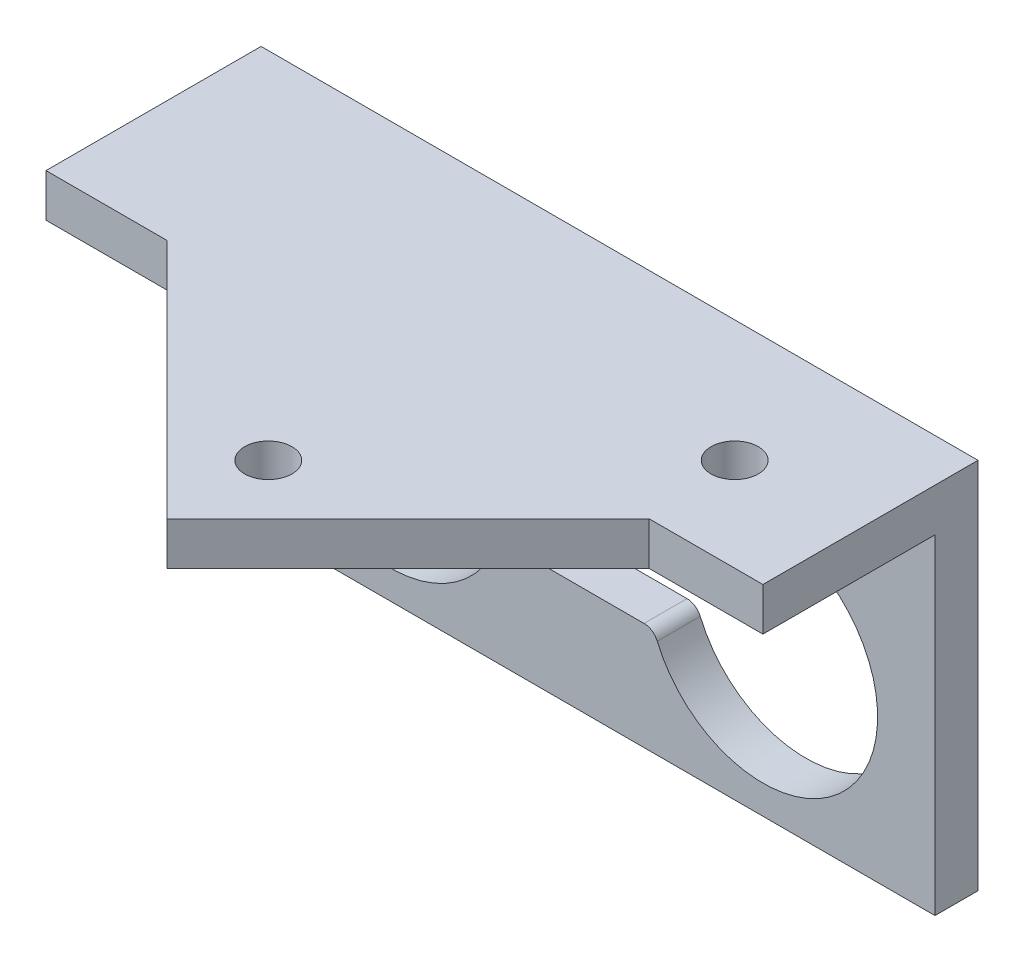
from build123d import *

# Parameters (mm, degrees)
SKETCH_1_W          = 50
SKETCH_1_H          = 20
EXTRUDE_1_DEPTH     = 3
SKETCH_2_W          = 50
SKETCH_2_H          = 15
EXTRUDE_2_DEPTH     = 6
SKETCH_5_W          = 50
SKETCH_5_H          = 12
CUT_EXTRUDE_2_DEPTH = 3
SKETCH_7_R          = 1.65
EXTRUDE_3_DEPTH     = 3
SKETCH_8_R          = 1.65
CUT_EXTRUDE_3_DEPTH = 3


with BuildPart() as part:
    # 草图1 → 凸台-拉伸1 (new body)
    with BuildSketch(Plane.XY):
        Rectangle(SKETCH_1_W, SKETCH_1_H)
        with BuildLine():
            Line((-4.708438024, 2.5), (4.708438024, 2.5))
            ThreePointArc((4.708438024, 2.5), (5.261208823, 2.666666667), (5.629722688, 3.111111111))
            ThreePointArc((5.629722688, 3.111111111), (21, 0), (5.629722688, -3.111111111))
            ThreePointArc((5.629722688, -3.111111111), (5.261208823, -2.666666667), (4.708438024, -2.5))
            Line((4.708438024, -2.5), (-4.708438024, -2.5))
            ThreePointArc((-4.708438024, -2.5), (-5.261208823, -2.666666667), (-5.629722688, -3.111111111))
            ThreePointArc((-5.629722688, -3.111111111), (-21, 0), (-5.629722688, 3.111111111))
            ThreePointArc((-5.629722688, 3.111111111), (-5.261208823, 2.666666667), (-4.708438024, 2.5))
        make_face(mode=Mode.SUBTRACT)
        with BuildLine():
            Line((3.25, 5.5), (-3.25, 5.5))
            ThreePointArc((-3.25, 5.5), (-5, 7.25), (-3.25, 9))
            Line((-3.25, 9), (3.25, 9))
            ThreePointArc((3.25, 9), (5, 7.25), (3.25, 5.5))
        make_face(mode=Mode.SUBTRACT)
    extrude(amount=EXTRUDE_1_DEPTH)

    # 草图2 → 凸台-拉伸2 (add)
    with BuildSketch(Plane(origin=(0, 10, 0), x_dir=(1, 0, 0), z_dir=(0, 1, 0))):
        with Locations((0, -7.5)):
            Rectangle(SKETCH_2_W, SKETCH_2_H)
    extrude(amount=EXTRUDE_2_DEPTH)

    # 草图5 → 切除-拉伸2 (cut)
    with BuildSketch(Plane.XZ.offset(-10)):
        with Locations((0, 9)):
            Rectangle(SKETCH_5_W, SKETCH_5_H)
    extrude(amount=-CUT_EXTRUDE_2_DEPTH, mode=Mode.SUBTRACT)

    # 草图7 → 凸台-拉伸3 (add)
    with BuildSketch(Plane(origin=(0, 16, 0), x_dir=(1, 0, 0), z_dir=(0, 1, 0))):
        Polygon((-16.568542495, -15), (17.071067812, -15), (0.251262658, -31.819805153), align=None)
        with Locations((0.251262658, -24.748737342)):
            Circle(SKETCH_7_R, mode=Mode.SUBTRACT)
    extrude(amount=-EXTRUDE_3_DEPTH)

    # 草图8 → 切除-拉伸3 (cut)
    with BuildSketch(Plane(origin=(0, 16, 0), x_dir=(1, 0, 0), z_dir=(0, 1, 0))):
        with Locations(Location((16.514718626, -8.485281374, 0), (0, 0, 180))):
            Circle(SKETCH_8_R)
    extrude(amount=-CUT_EXTRUDE_3_DEPTH, mode=Mode.SUBTRACT)


solid = part.part
